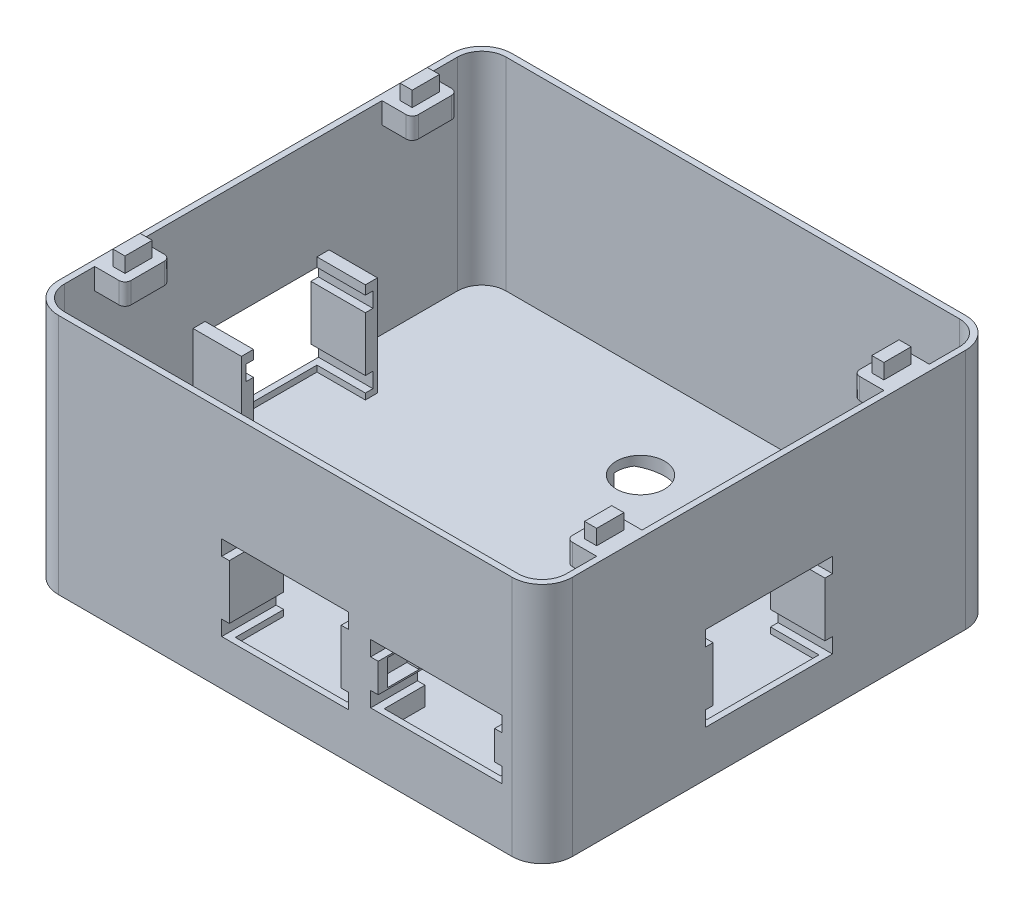
from build123d import *

# Parameters (mm, degrees)
SKETCH2_W                                  = 170
SKETCH2_H                                  = 150
BOSS_EXTRUDE1_DEPTH                        = 80
FILLET1_R                                  = 10
SHELL1_T                                   = -2
SHELL1_THICKNESS_2_DEPTH                   = 11
SKETCH5_W                                  = 2.5
SKETCH5_H                                  = 5
CUT_EXTRUDE1_DEPTH                         = 2
BOSS_EXTRUDE2_DEPTH                        = 16
SKETCH7_W                                  = 2.5
SKETCH7_H                                  = 5
CUT_EXTRUDE2_DEPTH                         = 2
BOSS_EXTRUDE3_DEPTH                        = 16
SKETCH10_W                                 = 2.5
SKETCH10_H                                 = 5
CUT_EXTRUDE4_DEPTH                         = 2
BOSS_EXTRUDE4_DEPTH                        = 16
SKETCH13_W                                 = 2.5
SKETCH13_H                                 = 5
CUT_EXTRUDE5_DEPTH                         = 2
BOSS_EXTRUDE5_DEPTH                        = 13.5
SKETCH15_W                                 = 10.5
SKETCH15_H                                 = 8.6
CUT_EXTRUDE6_DEPTH                         = 4
CUT_EXTRUDE8_REACH                         = 140.744
SKETCH20_R                                 = 8
SKETCH22_R                                 = 3
CUT_EXTRUDE9_DEPTH                         = 5
BOSS_EXTRUDE6_START                        = 60
SKETCH23_W                                 = 10
SKETCH23_H                                 = 15
BOSS_EXTRUDE6_DEPTH                        = 7
SKETCH24_W                                 = 4
SKETCH24_H                                 = 9
CUT_EXTRUDE10_DEPTH                        = 5
MIRROR1_START                              = 60
MIRROR1_AT_THE_SECOND_PLANE_COPY_1_SKETC_W = 10
MIRROR1_AT_THE_SECOND_PLANE_COPY_1_SKETC_H = 15
MIRROR1_AT_THE_SECOND_PLANE_COPY_1_DEPTH   = 7
MIRROR1_AT_THE_SECOND_PLANE_COPY_2_SKETC_W = 4
MIRROR1_AT_THE_SECOND_PLANE_COPY_2_SKETC_H = 9
MIRROR1_AT_THE_SECOND_PLANE_COPY_2_DEPTH   = 5
FILLET2_R                                  = 2
CUT_EXTRUDE14_DEPTH                        = 10
SKETCH30_R                                 = 6
CUT_EXTRUDE16_DEPTH                        = 10
SKETCH31_W                                 = 4
SKETCH31_H                                 = 9
BOSS_EXTRUDE7_DEPTH                        = 10


with BuildPart() as part:
    # Sketch2 → Boss-Extrude1 (new body)
    with BuildSketch(Plane(origin=(0, 0, 0), x_dir=(1, 0, 0), z_dir=(0, 1, 0))):
        Rectangle(SKETCH2_W, SKETCH2_H)
    extrude(amount=BOSS_EXTRUDE1_DEPTH)

    # Fillet1
    fillet1_edges = [part.edges().sort_by_distance(p)[0] for p in [
        (85, 40, 75),
        (-85, 40, 75),
        (-85, 40, -75),
        (85, 40, -75),
    ]]
    fillet(fillet1_edges, radius=FILLET1_R)

    # Shell1
    shell1_openings = [part.faces().sort_by_distance(p)[0] for p in [
        (0, 80, 0),
    ]]
    offset(amount=SHELL1_T, openings=shell1_openings, kind=Kind.INTERSECTION)

    # Shell1 thickness 2 face (on inner face of the shell) → Shell1 thickness 2 (add)
    with BuildSketch(Plane(origin=(0, 2, 0), x_dir=(0, 0, -1), z_dir=(0, -1, 0))):
        with BuildLine():
            ThreePointArc((73, -75), (70.656854249, -80.656854249), (65, -83))
            Line((65, -83), (-65, -83))
            ThreePointArc((-65, -83), (-70.656854249, -80.656854249), (-73, -75))
            Line((-73, -75), (-73, 75))
            ThreePointArc((-73, 75), (-70.656854249, 80.656854249), (-65, 83))
            Line((-65, 83), (65, 83))
            ThreePointArc((65, 83), (70.656854249, 80.656854249), (73, 75))
            Line((73, 75), (73, -75))
        make_face()
    extrude(amount=-SHELL1_THICKNESS_2_DEPTH)

    # Sketch5 → Cut-Extrude1 (cut)
    with BuildSketch(Plane.XY.offset(75)):
        Polygon((18.5, 43), (-18.5, 43), (-18.5, 38), (-18.5, 20), (-18.5, 15), (18.5, 15), (18.5, 20), (18.5, 38), align=None)
        with Locations((-19.75, 40.5)):
            Rectangle(SKETCH5_W, SKETCH5_H)
        with Locations((19.75, 40.5)):
            Rectangle(SKETCH5_W, SKETCH5_H)
        with Locations((-19.75, 17.5)):
            Rectangle(SKETCH5_W, SKETCH5_H)
        with Locations((19.75, 17.5)):
            Rectangle(SKETCH5_W, SKETCH5_H)
    extrude(amount=-CUT_EXTRUDE1_DEPTH, mode=Mode.SUBTRACT)

    # Sketch6 → Boss-Extrude2 (add)
    with BuildSketch(Plane(origin=(0, 0, 73), x_dir=(-1, 0, 0), z_dir=(0, 0, -1))):
        Polygon((18.5, 13), (22.5, 13), (22.5, 46), (18.5, 46), (18.5, 43), (21, 43), (21, 38), (18.5, 38), (18.5, 20), (21, 20), (21, 15), (18.5, 15), align=None)
        Polygon((-22.5, 46), (-22.5, 13), (-18.5, 13), (-18.5, 15), (-21, 15), (-21, 20), (-18.5, 20), (-18.5, 38), (-21, 38), (-21, 43), (-18.5, 43), (-18.5, 46), align=None)
    extrude(amount=BOSS_EXTRUDE2_DEPTH)

    # Sketch7 → Cut-Extrude2 (cut)
    with BuildSketch(Plane(origin=(85, 0, 0), x_dir=(0, 0, -1), z_dir=(1, 0, 0))):
        Polygon((18.5, 43), (-18.5, 43), (-18.5, 38), (-18.5, 20), (-18.5, 15), (18.5, 15), (18.5, 20), (18.5, 38), align=None)
        with Locations((-19.75, 40.5)):
            Rectangle(SKETCH7_W, SKETCH7_H)
        with Locations((19.75, 40.5)):
            Rectangle(SKETCH7_W, SKETCH7_H)
        with Locations((-19.75, 17.5)):
            Rectangle(SKETCH7_W, SKETCH7_H)
        with Locations((19.75, 17.5)):
            Rectangle(SKETCH7_W, SKETCH7_H)
    extrude(amount=-CUT_EXTRUDE2_DEPTH, mode=Mode.SUBTRACT)

    # Sketch8 → Boss-Extrude3 (add)
    with BuildSketch(Plane.ZY.offset(-83)):
        Polygon((-22.5, 46), (-18.5, 46), (-18.5, 43), (-21, 43), (-21, 38), (-18.5, 38), (-18.5, 20), (-21, 20), (-21, 15), (-18.5, 15), (-18.5, 13), (-22.5, 13), align=None)
        Polygon((21, 43), (18.5, 43), (18.5, 46), (22.5, 46), (22.5, 13), (18.5, 13), (18.5, 15), (21, 15), (21, 20), (18.5, 20), (18.5, 38), (21, 38), align=None)
    extrude(amount=BOSS_EXTRUDE3_DEPTH)

    # Sketch10 → Cut-Extrude4 (cut)
    with BuildSketch(Plane.ZY.offset(85)):
        Polygon((18.5, 43), (-18.5, 43), (-18.5, 38), (-18.5, 20), (-18.5, 15), (18.5, 15), (18.5, 20), (18.5, 38), align=None)
        with Locations((-19.75, 40.5)):
            Rectangle(SKETCH10_W, SKETCH10_H)
        with Locations((19.75, 40.5)):
            Rectangle(SKETCH10_W, SKETCH10_H)
        with Locations((-19.75, 17.5)):
            Rectangle(SKETCH10_W, SKETCH10_H)
        with Locations((19.75, 17.5)):
            Rectangle(SKETCH10_W, SKETCH10_H)
    extrude(amount=-CUT_EXTRUDE4_DEPTH, mode=Mode.SUBTRACT)

    # Sketch11 → Boss-Extrude4 (add)
    with BuildSketch(Plane(origin=(-83, 0, 0), x_dir=(0, 0, -1), z_dir=(1, 0, 0))):
        Polygon((-18.5, 46), (-22.5, 46), (-22.5, 13), (-18.5, 13), (-18.5, 15), (-21, 15), (-21, 20), (-18.5, 20), (-18.5, 38), (-21, 38), (-21, 43), (-18.5, 43), align=None)
        Polygon((21, 43), (18.5, 43), (18.5, 46), (22.5, 46), (22.5, 13), (18.5, 13), (18.5, 15), (21, 15), (21, 20), (18.5, 20), (18.5, 38), (21, 38), align=None)
    extrude(amount=BOSS_EXTRUDE4_DEPTH)

    # Sketch13 → Cut-Extrude5 (cut)
    with BuildSketch(Plane.XY.offset(75)):
        with Locations((29.5, 36.3)):
            Rectangle(SKETCH13_W, SKETCH13_H)
        Polygon((69.25, 38.8), (30.75, 38.8), (30.75, 33.8), (30.75, 24.2), (30.75, 19.2), (69.25, 19.2), (69.25, 24.2), (69.25, 33.8), align=None)
        with Locations((70.5, 36.3)):
            Rectangle(SKETCH13_W, SKETCH13_H)
        with Locations((29.5, 21.7)):
            Rectangle(SKETCH13_W, SKETCH13_H)
        with Locations((70.5, 21.7)):
            Rectangle(SKETCH13_W, SKETCH13_H)
    extrude(amount=-CUT_EXTRUDE5_DEPTH, mode=Mode.SUBTRACT)

    # Sketch14 → Boss-Extrude5 (add)
    with BuildSketch(Plane(origin=(0, 0, 73), x_dir=(-1, 0, 0), z_dir=(0, 0, -1))):
        Polygon((-69.25, 41.8), (-73.25, 41.8), (-73.25, 13), (-69.25, 13), (-69.25, 19.2), (-71.75, 19.2), (-71.75, 24.2), (-69.25, 24.2), (-69.25, 33.8), (-71.75, 33.8), (-71.75, 38.8), (-69.25, 38.8), align=None)
        Polygon((-28.25, 38.8), (-30.75, 38.8), (-30.75, 41.8), (-26.75, 41.8), (-26.75, 13), (-30.75, 13), (-30.75, 19.2), (-28.25, 19.2), (-28.25, 24.2), (-30.75, 24.2), (-30.75, 33.8), (-28.25, 33.8), align=None)
    extrude(amount=BOSS_EXTRUDE5_DEPTH)

    # Sketch15 → Cut-Extrude6 (cut)
    with BuildSketch(Plane.ZY.offset(-26.75)):
        with Locations((66.75, 29)):
            Rectangle(SKETCH15_W, SKETCH15_H)
    extrude(amount=-CUT_EXTRUDE6_DEPTH, mode=Mode.SUBTRACT)

    # Sketch18 → Cut-Revolve1 (revolve, cut)
    with BuildSketch(Plane(origin=(0, 0, 0), x_dir=(0, 0, -1), z_dir=(1, 0, 0)), mode=Mode.PRIVATE) as cut_revolve1_sk:
        Polygon((-42.5, 0), (-70, 0), (-47.5, 10), (-42.5, 10), align=None)
    revolve(cut_revolve1_sk.sketch.rotate(Axis((0, 0, 0), (0, 1, 0)), 180), axis=Axis((0, 0, 0), (0, 1, 0)), mode=Mode.SUBTRACT)

    # Cut-Extrude8: up to this face of the body (flat: up to its plane)
    cut_extrude8_end = Plane(part.part.faces().sort_by_distance((-0.227953307, 13, -0.653255078))[0])
    # Sketch20 → Cut-Extrude8 (cut, up to the picked face)
    with BuildSketch(Plane.XZ, mode=Mode.PRIVATE) as cut_extrude8_sk1:
        with Locations(Location((0, -42.5, 0), (0, 0, 270))):
            Circle(SKETCH20_R)
    cut_extrude8_tool1 = split(extrude(cut_extrude8_sk1.sketch, amount=-CUT_EXTRUDE8_REACH, mode=Mode.PRIVATE), bisect_by=cut_extrude8_end, keep=Keep.BOTH, mode=Mode.PRIVATE)
    add(cut_extrude8_tool1.solids().sort_by(Axis((0, 0, -42.5), (0, 1, 0)))[0], mode=Mode.SUBTRACT)

    # Sketch22 → Cut-Extrude9 (cut)
    with BuildSketch(Plane.XZ):
        with Locations(Location((-67.928932188, 57.928932188, 0), (0, 0, 270))):
            Circle(SKETCH22_R)
        with Locations(Location((-67.928932188, -57.928932188, 0), (0, 0, 90))):
            Circle(SKETCH22_R)
        with Locations(Location((67.928932188, -57.928932188, 0), (0, 0, 270))):
            Circle(SKETCH22_R)
        with Locations(Location((67.928932188, 57.928932188, 0), (0, 0, 90))):
            Circle(SKETCH22_R)
    extrude(amount=-CUT_EXTRUDE9_DEPTH, mode=Mode.SUBTRACT)

    # Sketch23 → Boss-Extrude6 (add)
    with BuildSketch(Plane(origin=(0, 13, 0), x_dir=(1, 0, 0), z_dir=(0, 1, 0)).offset(BOSS_EXTRUDE6_START)):
        with Locations((-78, 47.5)):
            Rectangle(SKETCH23_W, SKETCH23_H)
    boss_extrude6 = extrude(amount=BOSS_EXTRUDE6_DEPTH)

    # Sketch24 → Cut-Extrude10 (cut)
    with BuildSketch(Plane(origin=(0, 80, 0), x_dir=(1, 0, 0), z_dir=(0, 1, 0))):
        with Locations((-78, 47.5)):
            Rectangle(SKETCH24_W, SKETCH24_H)
    cut_extrude10 = extrude(amount=-CUT_EXTRUDE10_DEPTH, mode=Mode.SUBTRACT)

    # Mirror1: Boss-Extrude6, Cut-Extrude10 across plane
    add(boss_extrude6.mirror(Plane(origin=(0, 0, 0), x_dir=(0, 0, 1), z_dir=(1, 0, 0))))
    add(cut_extrude10.mirror(Plane(origin=(0, 0, 0), x_dir=(0, 0, 1), z_dir=(1, 0, 0))), mode=Mode.SUBTRACT)

    # Mirror1 at the second plane: Boss-Extrude6, Cut-Extrude10 across plane
    add(boss_extrude6.mirror(Plane.XY))
    add(cut_extrude10.mirror(Plane.XY), mode=Mode.SUBTRACT)

    # Mirror1 at the second plane copy 1 sketc → Mirror1 at the second plane copy 1 (add)
    with BuildSketch(Plane(origin=(0, 13, 0), x_dir=(-1, 0, 0), z_dir=(0, 1, 0)).offset(MIRROR1_START)):
        with Locations((-78, 47.5)):
            Rectangle(MIRROR1_AT_THE_SECOND_PLANE_COPY_1_SKETC_W, MIRROR1_AT_THE_SECOND_PLANE_COPY_1_SKETC_H)
    extrude(amount=MIRROR1_AT_THE_SECOND_PLANE_COPY_1_DEPTH)

    # Mirror1 at the second plane copy 2 sketc → Mirror1 at the second plane copy 2 (cut)
    with BuildSketch(Plane(origin=(0, 80, 0), x_dir=(-1, 0, 0), z_dir=(0, 1, 0))):
        with Locations((-78, 47.5)):
            Rectangle(MIRROR1_AT_THE_SECOND_PLANE_COPY_2_SKETC_W, MIRROR1_AT_THE_SECOND_PLANE_COPY_2_SKETC_H)
    extrude(amount=-MIRROR1_AT_THE_SECOND_PLANE_COPY_2_DEPTH, mode=Mode.SUBTRACT)

    # Fillet2
    fillet2_edges = [part.edges().sort_by_distance(p)[0] for p in [
        (-73, 76.5, -40),
        (-73, 76.5, -55),
        (-73, 76.5, 40),
        (-73, 76.5, 55),
        (73, 76.5, -40),
        (73, 76.5, -55),
        (73, 76.5, 40),
        (73, 76.5, 55),
    ]]
    fillet(fillet2_edges, radius=FILLET2_R)

    # Sketch28 → Cut-Extrude14 (cut)
    with BuildSketch(Plane.XZ):
        with BuildLine():
            ThreePointArc((10.117209293, -38.182352941), (0, -31.5), (-10.117209293, -38.182352941))
            ThreePointArc((-10.117209293, -38.182352941), (0, 39.5), (10.117209293, -38.182352941))
        make_face()
    extrude(amount=-CUT_EXTRUDE14_DEPTH, mode=Mode.SUBTRACT)

    # Sketch30 → Cut-Extrude16 (cut)
    # profile 1 of 2: a face of its own
    with BuildSketch(Plane.XZ):
        with BuildLine():
            Line((12.041594579, -72), (75, -72))
            ThreePointArc((75, -72), (79.949747468, -69.949747468), (82, -65))
            Line((82, -65), (82, 65))
            ThreePointArc((82, 65), (79.949747468, 69.949747468), (75, 72))
            Line((75, 72), (12.041594579, 72))
            ThreePointArc((12.041594579, 72), (73, 0), (12.041594579, -72))
        make_face()
        with Locations(Location((67.928932188, 57.928932188, 0), (0, 0, 270))):
            Circle(SKETCH30_R, mode=Mode.SUBTRACT)
        with Locations(Location((67.928932188, -57.928932188, 0), (0, 0, 270))):
            Circle(SKETCH30_R, mode=Mode.SUBTRACT)
    # profile 2 of 2: a face of its own
    with BuildSketch(Plane.XZ):
        with BuildLine():
            Line((-12.041594579, 72), (-75, 72))
            ThreePointArc((-75, 72), (-79.949747468, 69.949747468), (-82, 65))
            Line((-82, 65), (-82, -65))
            ThreePointArc((-82, -65), (-79.949747468, -69.949747468), (-75, -72))
            Line((-75, -72), (-12.041594579, -72))
            ThreePointArc((-12.041594579, -72), (-73, 0), (-12.041594579, 72))
        make_face()
        with Locations(Location((-67.928932188, -57.928932188, 0), (0, 0, 270))):
            Circle(SKETCH30_R, mode=Mode.SUBTRACT)
        with Locations(Location((-67.928932188, 57.928932188, 0), (0, 0, 270))):
            Circle(SKETCH30_R, mode=Mode.SUBTRACT)
    extrude(amount=-CUT_EXTRUDE16_DEPTH, mode=Mode.SUBTRACT)

    # Sketch31 → Boss-Extrude7 (add)
    with BuildSketch(Plane(origin=(0, 75, 0), x_dir=(1, 0, 0), z_dir=(0, 1, 0))):
        with Locations((-78, 47.5)):
            Rectangle(SKETCH31_W, SKETCH31_H)
        with Locations((-78, -47.5)):
            Rectangle(SKETCH31_W, SKETCH31_H)
        with Locations((78, 47.5)):
            Rectangle(SKETCH31_W, SKETCH31_H)
        with Locations((78, -47.5)):
            Rectangle(SKETCH31_W, SKETCH31_H)
    extrude(amount=BOSS_EXTRUDE7_DEPTH)


solid = part.part
